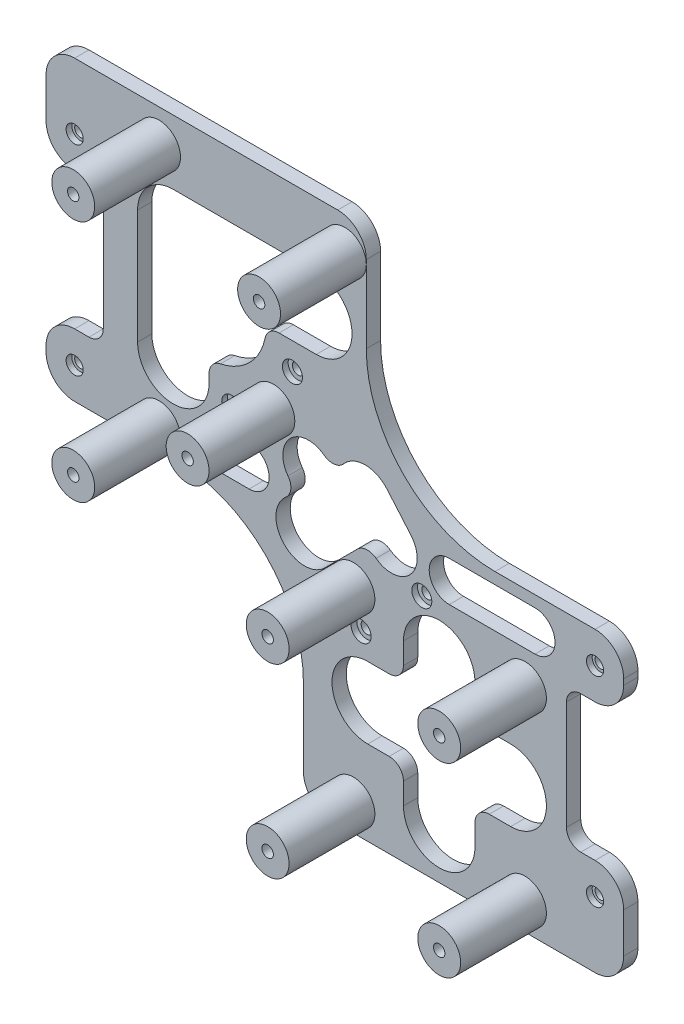
from build123d import *

# Parameters (mm, degrees)
SKICA1_W                 = 202
SKICA1_H                 = 202
P_IDAT_VYSUNUT_M1_DEPTH  = 5
ODEBRAT_VYSUNUT_M1_DEPTH = 10
SKICA3_R                 = 2
ODEBRAT_VYSUNUT_M2_DEPTH = 143.923056223
SKICA4_R                 = 3
ODEBRAT_VYSUNUT_M3_DEPTH = 2
SKICA6_R                 = 7.5
P_IDAT_VYSUNUT_M2_DEPTH  = 30
SKICA7_R                 = 2
ODEBRAT_VYSUNUT_M4_DEPTH = 148.061211745
SKICA9_R                 = 3.5
ODEBRAT_VYSUNUT_M6_DEPTH = 2
SKICA11_R                = 2
ODEBRAT_VYSUNUT_M7_DEPTH = 146.95204692
SKICA13_W                = 112
SKICA13_H                = 8
SKICA13_W_2              = 20
SKICA13_H_2              = 48
ODEBRAT_VYSUNUT_M8_DEPTH = 146.95204692
SKICA14_W                = 20
SKICA14_H                = 48
ODEBRAT_VYSUNUT_M9_DEPTH = 141.534693226
ZAOBLIT1_R               = 5
ZAOBLIT2_R               = 10


with BuildPart() as part:
    # Skica1 → Přidat vysunutím1 (new body)
    with BuildSketch(Plane.XY):
        Rectangle(SKICA1_W, SKICA1_H)
    extrude(amount=P_IDAT_VYSUNUT_M1_DEPTH)

    # Skica2 → Odebrat vysunutím1 (cut)
    with BuildSketch(Plane.XY.offset(5)):
        with BuildLine():
            Line((11, 56), (11, 101))
            Line((11, 101), (101, 101))
            Line((101, 101), (101, 11))
            Line((101, 11), (56, 11))
            ThreePointArc((56, 11), (24.180194847, 24.180194847), (11, 56))
        make_face()
        with BuildLine():
            Line((-56, -11), (-101, -11))
            Line((-101, -11), (-101, -101))
            Line((-101, -101), (-11, -101))
            Line((-11, -101), (-11, -56))
            ThreePointArc((-11, -56), (-24.180194847, -24.180194847), (-56, -11))
        make_face()
    extrude(amount=-ODEBRAT_VYSUNUT_M1_DEPTH, mode=Mode.SUBTRACT)

    # Skica3 → Odebrat vysunutím2 (cut, through all)
    with BuildSketch(Plane.XY.offset(5)):
        with Locations((91, 0)):
            Circle(SKICA3_R)
        with Locations(Location((-91, 0, 0), (0, 0, 180))):
            Circle(SKICA3_R)
        with Locations((91, -70)):
            Circle(SKICA3_R)
        with Locations(Location((-91, 70, 0), (0, 0, 180))):
            Circle(SKICA3_R)
    extrude(amount=-ODEBRAT_VYSUNUT_M2_DEPTH, mode=Mode.SUBTRACT)

    # Skica4 → Odebrat vysunutím3 (cut)
    with BuildSketch(Plane.XY.offset(5)):
        with Locations((91, 0)):
            Circle(SKICA4_R)
        with Locations(Location((-91, 0, 0), (0, 0, 180))):
            Circle(SKICA4_R)
        with Locations((91, -70)):
            Circle(SKICA4_R)
        with Locations(Location((-91, 70, 0), (0, 0, 180))):
            Circle(SKICA4_R)
    extrude(amount=-ODEBRAT_VYSUNUT_M3_DEPTH, mode=Mode.SUBTRACT)

    # Skica6 → Přidat vysunutím2 (add)
    with BuildSketch(Plane.XY.offset(5)):
        with Locations((-61.5, 81.5)):
            Circle(SKICA6_R)
        with Locations(Location((-61.5, -3.5, 0), (0, 0, 270))):
            Circle(SKICA6_R)
        with Locations((3.5, 81.5)):
            Circle(SKICA6_R)
        with Locations((-21.5, 21.5)):
            Circle(SKICA6_R)
        with Locations((6.5, -18.5)):
            Circle(SKICA6_R)
        with Locations((6.5, -83.5)):
            Circle(SKICA6_R)
        with Locations(Location((66.5, -18.5, 0), (0, 0, 180))):
            Circle(SKICA6_R)
        with Locations(Location((66.5, -83.5, 0), (0, 0, 180))):
            Circle(SKICA6_R)
    extrude(amount=P_IDAT_VYSUNUT_M2_DEPTH)

    # Skica7 → Odebrat vysunutím4 (cut, through all)
    with BuildSketch(Plane.XY.offset(35)):
        with Locations((-21.5, 21.5)):
            Circle(SKICA7_R)
        with Locations((-61.5, 81.5)):
            Circle(SKICA7_R)
        with Locations((3.5, 81.5)):
            Circle(SKICA7_R)
        with Locations((-61.5, -3.5)):
            Circle(SKICA7_R)
        with Locations((6.5, -18.5)):
            Circle(SKICA7_R)
        with Locations((66.5, -18.5)):
            Circle(SKICA7_R)
        with Locations((6.5, -83.5)):
            Circle(SKICA7_R)
        with Locations((66.5, -83.5)):
            Circle(SKICA7_R)
    extrude(amount=-ODEBRAT_VYSUNUT_M4_DEPTH, mode=Mode.SUBTRACT)

    # Skica9 → Odebrat vysunutím6 (cut)
    with BuildSketch(Plane.XY.offset(5)):
        with Locations((-14.849242405, 36.062445841)):
            Circle(SKICA9_R)
        with Locations(Location((-36.062445841, 14.849242405, 0), (0, 0, 180))):
            Circle(SKICA9_R)
        with Locations(Location((30.405591591, -9.192388155, 0), (0, 0, 180))):
            Circle(SKICA9_R)
        with Locations((9.192388155, -30.405591591)):
            Circle(SKICA9_R)
    extrude(amount=-ODEBRAT_VYSUNUT_M6_DEPTH, mode=Mode.SUBTRACT)

    # Skica11 → Odebrat vysunutím7 (cut, through all)
    with BuildSketch(Plane.XY.offset(5)):
        with Locations((-36.062445841, 14.849242405)):
            Circle(SKICA11_R)
        with Locations((-14.849242405, 36.062445841)):
            Circle(SKICA11_R)
        with Locations((30.405591591, -9.192388155)):
            Circle(SKICA11_R)
        with Locations((9.192388155, -30.405591591)):
            Circle(SKICA11_R)
    extrude(amount=-ODEBRAT_VYSUNUT_M7_DEPTH, mode=Mode.SUBTRACT)

    # Skica13 → Odebrat vysunutím8 (cut, through all)
    with BuildSketch(Plane.XY.offset(5)):
        with BuildLine():
            Line((11.5, -38.5), (24, -38.5))
            Line((24, -38.5), (24, -26))
            ThreePointArc((24, -26), (36.5, -13.5), (49, -26))
            Line((49, -26), (49, -38.5))
            Line((49, -38.5), (61.5, -38.5))
            ThreePointArc((61.5, -38.5), (74, -51), (61.5, -63.5))
            Line((61.5, -63.5), (49, -63.5))
            Line((49, -63.5), (49, -76))
            ThreePointArc((49, -76), (36.5, -88.5), (24, -76))
            Line((24, -76), (24, -63.5))
            Line((24, -63.5), (11.5, -63.5))
            ThreePointArc((11.5, -63.5), (-1, -51), (11.5, -38.5))
        make_face()
        with Locations((-45, 97)):
            Rectangle(SKICA13_W, SKICA13_H)
        with Locations((45, -97)):
            Rectangle(SKICA13_W, SKICA13_H)
        with Locations((91, -35)):
            Rectangle(SKICA13_W_2, SKICA13_H_2)
        with BuildLine():
            Line((-3.535533906, -17.67766953), (11.313708499, -2.828427125))
            Line((11.313708499, -2.828427125), (13.435028843, -4.949747468))
            ThreePointArc((13.435028843, -4.949747468), (25.913285858, -5.189980909), (26.633630146, 7.269782907))
            Line((26.633630146, 7.269782907), (18.200646465, 17.112789878))
            ThreePointArc((18.200646465, 17.112789878), (10.441367607, 20.605236509), (2.80172418, 16.858312414))
            Line((2.80172418, 16.858312414), (0, 13.360531537))
            Line((0, 13.360531537), (-3.565848529, 16.216777939))
            ThreePointArc((-3.565848529, 16.216777939), (-15.556349186, 15.556349186), (-16.216777939, 3.565848529))
            Line((-16.216777939, 3.565848529), (-13.360531537, 0))
            Line((-13.360531537, 0), (-16.858312414, -2.80172418))
            ThreePointArc((-16.858312414, -2.80172418), (-18.055848259, -17.278087757), (-3.535533906, -17.67766953))
        make_face()
        with BuildLine():
            Line((70, 7), (40, 7))
            ThreePointArc((40, 7), (33, 0), (40, -7))
            Line((40, -7), (70, -7))
            ThreePointArc((70, -7), (77, 0), (70, 7))
        make_face()
        with BuildLine():
            Line((-42, -7), (-30, -7))
            ThreePointArc((-30, -7), (-23, 0), (-30, 7))
            Line((-30, 7), (-42, 7))
            ThreePointArc((-42, 7), (-49, 0), (-42, -7))
        make_face()
    extrude(amount=-ODEBRAT_VYSUNUT_M8_DEPTH, mode=Mode.SUBTRACT)

    # Skica14 → Odebrat vysunutím9 (cut, through all)
    with BuildSketch(Plane.XY.offset(5)):
        with Locations((-91, 35)):
            Rectangle(SKICA14_W, SKICA14_H)
        with BuildLine():
            Line((-69, 58), (-69, 18))
            ThreePointArc((-69, 18), (-56.5, 5.5), (-44, 18))
            Line((-44, 18), (-44, 25.5))
            ThreePointArc((-44, 25.5), (-29.857864376, 31.357864376), (-24, 45.5))
            Line((-24, 45.5), (-6.5, 45.5))
            ThreePointArc((-6.5, 45.5), (6, 58), (-6.5, 70.5))
            Line((-6.5, 70.5), (-56.5, 70.5))
            ThreePointArc((-56.5, 70.5), (-65.338834765, 66.838834765), (-69, 58))
        make_face()
    extrude(amount=-ODEBRAT_VYSUNUT_M9_DEPTH, mode=Mode.SUBTRACT)

    # Zaoblit1
    zaoblit1_edges = [part.edges().sort_by_distance(p)[0] for p in [
        (49, -38.5, 2.5),
        (24, -38.5, 2.5),
        (49, -63.5, 2.5),
        (24, -63.5, 2.5),
        (81, -59, 2.5),
        (81, -11, 2.5),
        (-24, 45.5, 2.5),
        (-44, 25.5, 2.5),
        (-81, 59, 2.5),
        (-81, 11, 2.5),
        (11.313708499, -2.828427125, 2.5),
        (-13.360531537, 0, 2.5),
        (0, 13.360531537, 2.5),
    ]]
    fillet(zaoblit1_edges, radius=ZAOBLIT1_R)

    # Zaoblit2
    zaoblit2_edges = [part.edges().sort_by_distance(p)[0] for p in [
        (101, 11, 2.5),
        (-101, 93, 2.5),
        (11, 93, 2.5),
        (101, -11, 2.5),
        (101, -59, 2.5),
        (-11, -93, 2.5),
        (101, -93, 2.5),
        (-101, -11, 2.5),
        (-101, 11, 2.5),
        (-101, 59, 2.5),
    ]]
    fillet(zaoblit2_edges, radius=ZAOBLIT2_R)


solid = part.part
